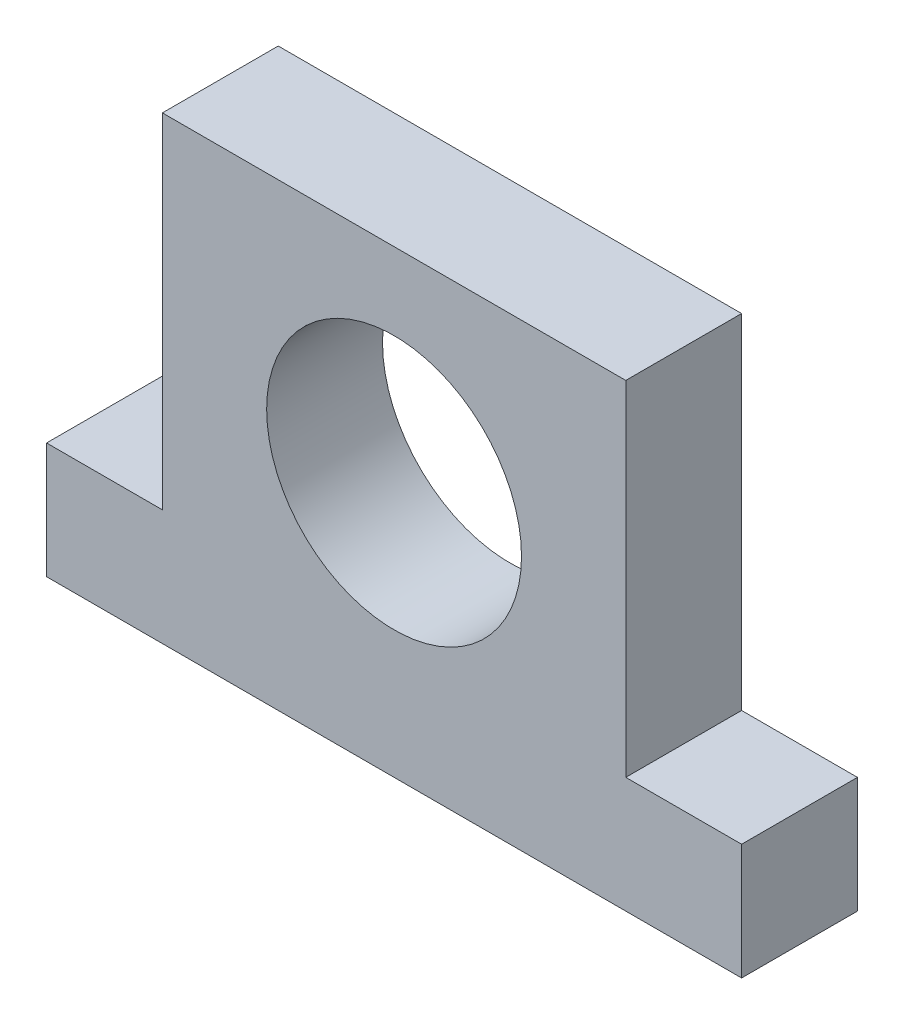
from build123d import *

# Parameters (mm, degrees)
SKETCH1_R           = 11
BOSS_EXTRUDE1_DEPTH = 10


with BuildPart() as part:
    # Sketch1 → Boss-Extrude1 (new body)
    with BuildSketch(Plane.XY):
        Polygon((0, 0), (10, 0), (10, 29.676479821), (50, 29.676479821), (50, 0), (60, 0), (60, -10), (0, -10), align=None)
        with Locations((30, 12.026328557)):
            Circle(SKETCH1_R, mode=Mode.SUBTRACT)
    extrude(amount=BOSS_EXTRUDE1_DEPTH)


solid = part.part
